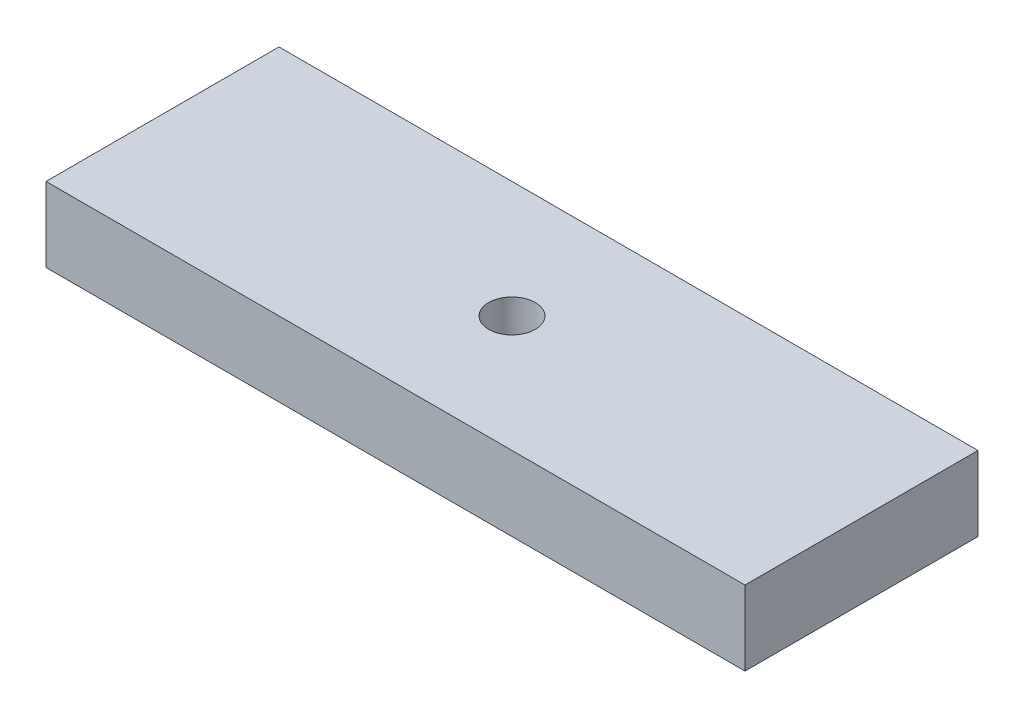
from build123d import *

# Parameters (mm, degrees)
CROQUIS1_W              = 150
CROQUIS1_H              = 50
SALIENTE_EXTRUIR1_DEPTH = 16
CROQUIS2_R              = 5
CORTAR_EXTRUIR1_DEPTH   = 81.65977932


with BuildPart() as part:
    # Croquis1 → Saliente-Extruir1 (new body)
    with BuildSketch(Plane(origin=(0, 0, 0), x_dir=(1, 0, 0), z_dir=(0, 1, 0))):
        Rectangle(CROQUIS1_W, CROQUIS1_H)
    extrude(amount=SALIENTE_EXTRUIR1_DEPTH)

    # Croquis2 → Cortar-Extruir1 (cut, through all)
    with BuildSketch(Plane(origin=(0, 16, 0), x_dir=(1, 0, 0), z_dir=(0, 1, 0))):
        with Locations(Location((0, 0, 0), (0, 0, 270))):
            Circle(CROQUIS2_R)
    extrude(amount=-CORTAR_EXTRUIR1_DEPTH, mode=Mode.SUBTRACT)


solid = part.part
